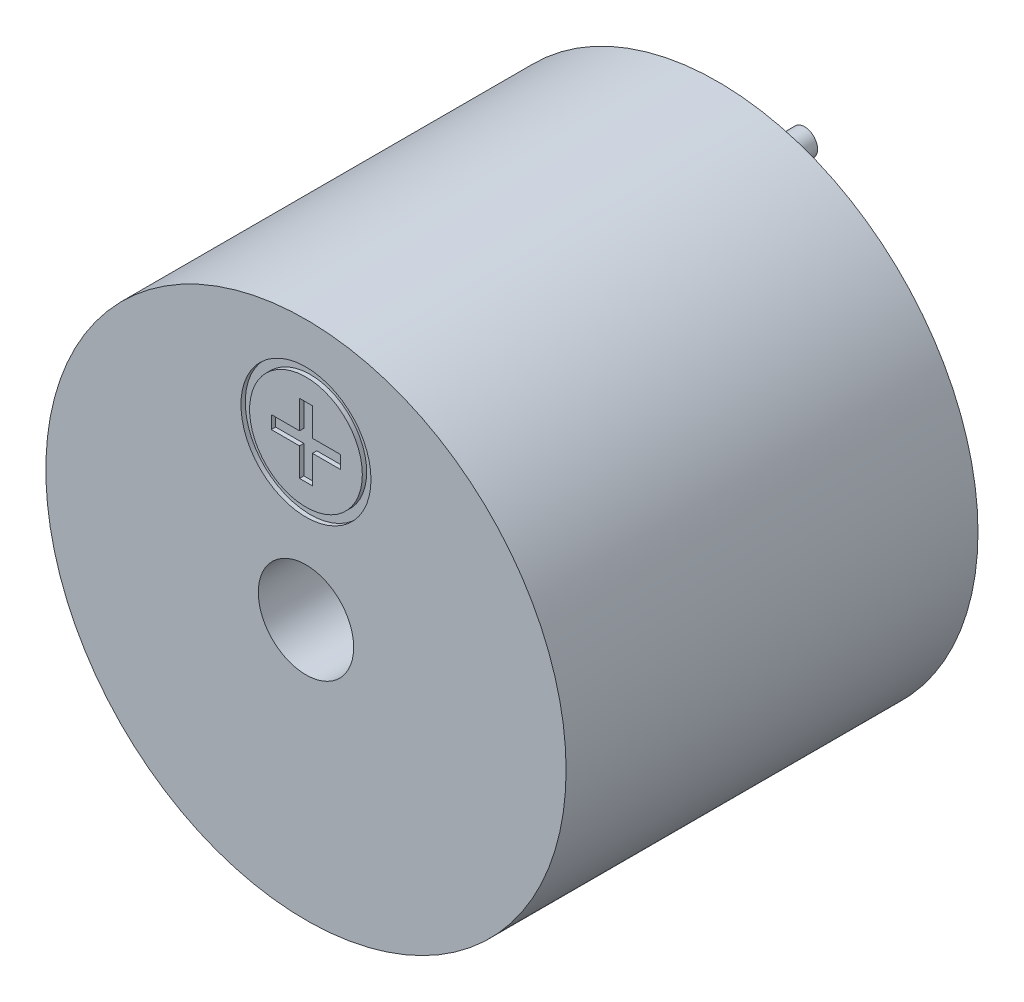
from build123d import *

# Parameters (mm, degrees)
SKETCH1_R           = 6
BOSS_EXTRUDE2_DEPTH = 3
SKETCH4_R           = 6
BOSS_EXTRUDE3_DEPTH = 6.5
SKETCH5_R           = 1.1
CUT_EXTRUDE2_DEPTH  = 6.5
SKETCH6_R           = 1.5
SKETCH6_R_2         = 1.3
CUT_EXTRUDE3_DEPTH  = 0.1
SKETCH7_R           = 0.3
BOSS_EXTRUDE4_DEPTH = 2


with BuildPart() as part:
    # Sketch1 → Boss-Extrude2 (new body)
    with BuildSketch(Plane.XY):
        Circle(SKETCH1_R)
    extrude(amount=BOSS_EXTRUDE2_DEPTH)

    # Sketch4 → Boss-Extrude3 (add)
    with BuildSketch(Plane.XY.offset(3)):
        Circle(SKETCH4_R)
    extrude(amount=BOSS_EXTRUDE3_DEPTH)

    # Sketch5 → Cut-Extrude2 (cut)
    with BuildSketch(Plane.XY.offset(9.5)):
        Circle(SKETCH5_R)
    extrude(amount=-CUT_EXTRUDE2_DEPTH, mode=Mode.SUBTRACT)

    # Sketch6 → Cut-Extrude3 (cut)
    # profile 1 of 2: a face of its own
    with BuildSketch(Plane.XY.offset(9.5)):
        with Locations((0, 3.55)):
            Circle(SKETCH6_R)
        with Locations((0, 3.55)):
            Circle(SKETCH6_R_2, mode=Mode.SUBTRACT)
    # profile 2 of 2: a face of its own
    with BuildSketch(Plane.XY.offset(9.5)):
        Polygon((-0.15, 2.75), (0.15, 2.75), (0.15, 3.4), (0.8, 3.4), (0.8, 3.55), (0.8, 3.7), (0.15, 3.7), (0.15, 4.35), (-0.15, 4.35), (-0.15, 3.7), (-0.8, 3.7), (-0.8, 3.4), (-0.15, 3.4), align=None)
    extrude(amount=-CUT_EXTRUDE3_DEPTH, mode=Mode.SUBTRACT)

    # Sketch7 → Boss-Extrude4 (add)
    with BuildSketch(Plane(origin=(0, 0, 0), x_dir=(-1, 0, 0), z_dir=(0, 0, -1))):
        with Locations(Location((0, 3.8, 0), (0, 0, 180))):
            Circle(SKETCH7_R)
        with Locations(Location((0, -3.8, 0), (0, 0, 180))):
            Circle(SKETCH7_R)
    extrude(amount=BOSS_EXTRUDE4_DEPTH)


solid = part.part
